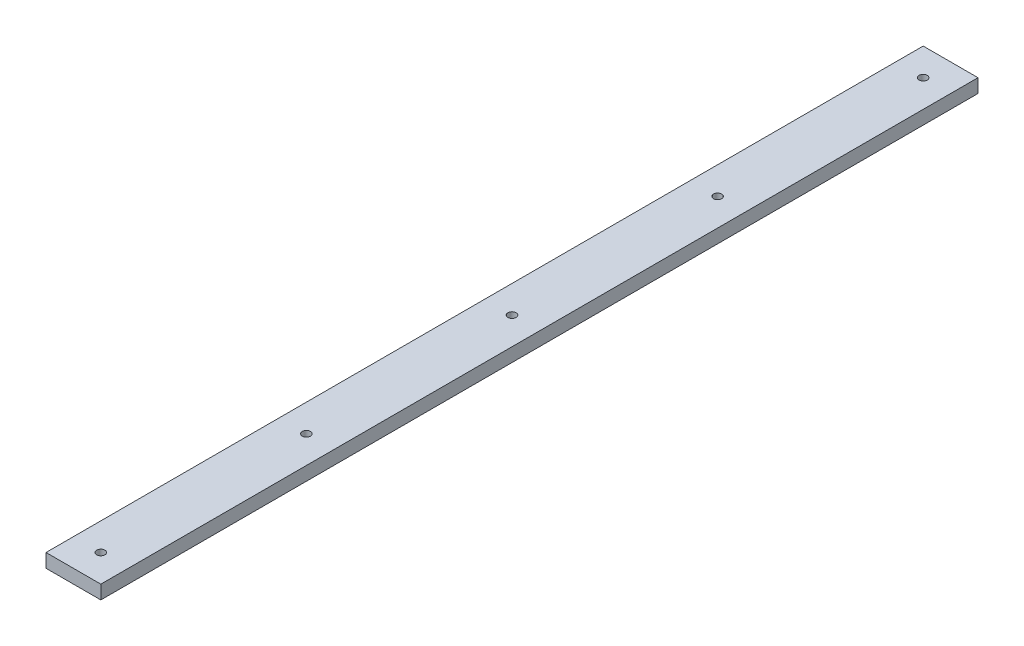
from build123d import *

# Parameters (mm, degrees)
SKETCH_1_W             = 40
SKETCH_1_H             = 640
EXTRUDE_1_DEPTH        = 5
SKETCH_2_R             = 3
CUT_EXTRUDE_1_DEPTH    = 321.780298647
PATTERN_LINEAR_1_COUNT = 5
PATTERN_LINEAR_1_PITCH = 150


with BuildPart() as part:
    # Эскиз1 → Бобышка-Вытянуть1 (new, symmetric)
    with BuildSketch(Plane(origin=(0, 0, 0), x_dir=(1, 0, 0), z_dir=(0, 1, 0))):
        Rectangle(SKETCH_1_W, SKETCH_1_H)
    extrude(amount=EXTRUDE_1_DEPTH, both=True)

    # Эскиз2 → Вырез-Вытянуть1 (cut, through all)
    with BuildSketch(Plane(origin=(0, 5, 0), x_dir=(1, 0, 0), z_dir=(0, 1, 0))):
        with Locations(Location((0, -300, 0), (0, 0, 270))):
            Circle(SKETCH_2_R)
    cut_extrude_1 = extrude(amount=-CUT_EXTRUDE_1_DEPTH, mode=Mode.SUBTRACT)

    # Линейный массив1: Вырез-Вытянуть1 ×5
    with Locations(*[(0, 0, -i * PATTERN_LINEAR_1_PITCH) for i in range(1, PATTERN_LINEAR_1_COUNT)]):
        add(cut_extrude_1, mode=Mode.SUBTRACT)


solid = part.part
